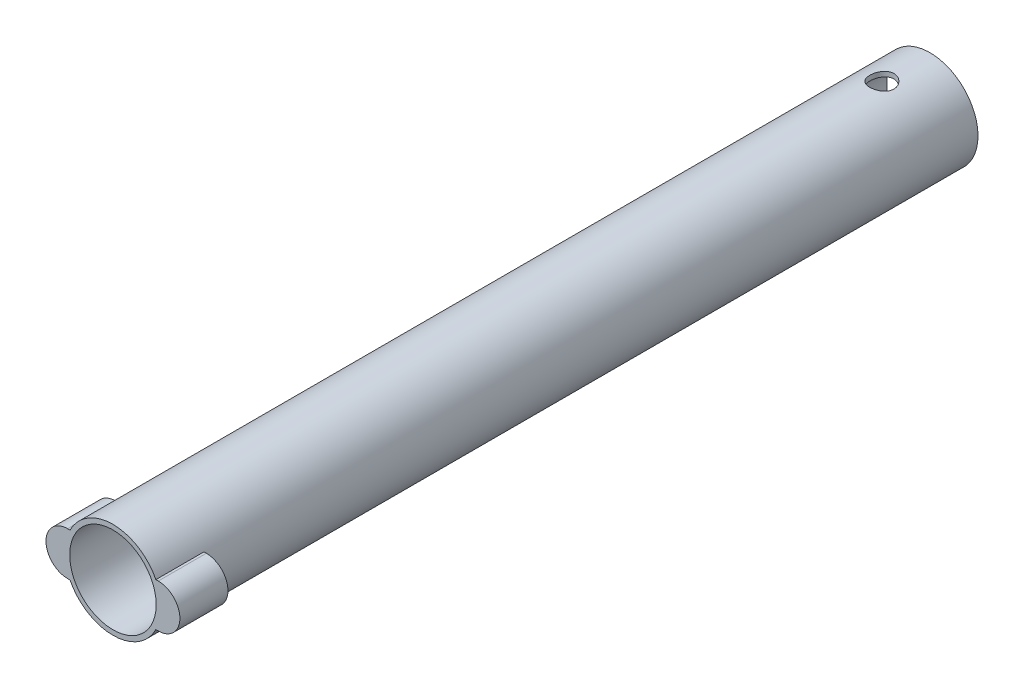
from build123d import *

# Parameters (mm, degrees)
SKETCH1_R               = 10
SKETCH1_R_2             = 9
BOSS_EXTRUDE1_DEPTH     = 170
BOSS_EXTRUDE2_START     = -10
BOSS_EXTRUDE2_DEPTH     = 10
CUT_EXTRUDE1_DEPTH      = 171.862672505
CUT_EXTRUDE1_DEPTH_BACK = 171.862672505
SKETCH3_R               = 2.5


with BuildPart() as part:
    # Sketch1 → Boss-Extrude1 (new body)
    with BuildSketch(Plane.XY):
        Circle(SKETCH1_R)
        Circle(SKETCH1_R_2, mode=Mode.SUBTRACT)
    extrude(amount=BOSS_EXTRUDE1_DEPTH)

    # Sketch2 → Boss-Extrude2 (add)
    with BuildSketch(Plane.XY.offset(170).offset(BOSS_EXTRUDE2_START)):
        with BuildLine():
            Line((-9.43028555, 4.5), (-8.93028555, 4.5))
            ThreePointArc((-8.93028555, 4.5), (-10, 0), (-8.93028555, -4.5))
            Line((-8.93028555, -4.5), (-9.43028555, -4.5))
            ThreePointArc((-9.43028555, -4.5), (-13.93028555, 0), (-9.43028555, 4.5))
        make_face()
        with BuildLine():
            Line((8.93028555, 4.5), (9.43028555, 4.5))
            ThreePointArc((9.43028555, 4.5), (13.93028555, 0), (9.43028555, -4.5))
            Line((9.43028555, -4.5), (8.93028555, -4.5))
            ThreePointArc((8.93028555, -4.5), (10, 0), (8.93028555, 4.5))
        make_face()
    extrude(amount=BOSS_EXTRUDE2_DEPTH)

    # Sketch3 → Cut-Extrude1 (cut, two sides: drawn at the far end of the back side and taken through both)
    with BuildSketch(Plane(origin=(0, 0, 0), x_dir=(1, 0, 0), z_dir=(0, 1, 0)).offset(-CUT_EXTRUDE1_DEPTH_BACK)):
        with Locations(Location((0, -10, 0), (0, 0, 270))):
            Circle(SKETCH3_R)
    extrude(amount=CUT_EXTRUDE1_DEPTH + CUT_EXTRUDE1_DEPTH_BACK, mode=Mode.SUBTRACT)


solid = part.part
